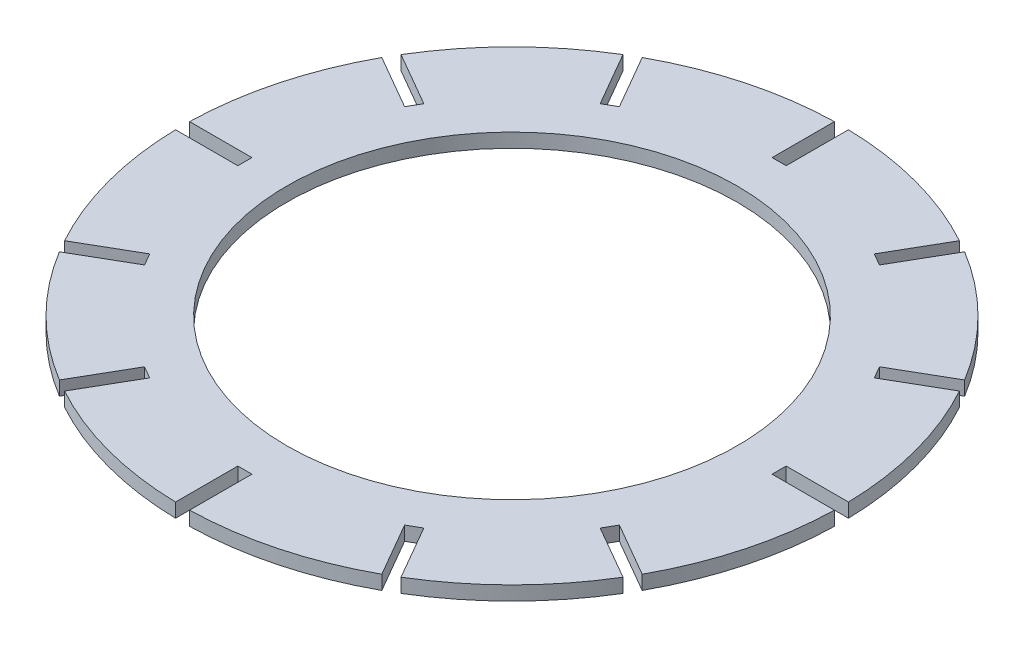
from build123d import *

# Parameters (mm, degrees)
SKETCH1_R           = 70.25
SKETCH1_R_2         = 48
BOSS_EXTRUDE1_DEPTH = 3
SKETCH2_W           = 13.3
SKETCH2_H           = 3
CUT_EXTRUDE1_DEPTH  = 3
CIRPATTERN1_COUNT   = 12


with BuildPart() as part:
    # Sketch1 → Boss-Extrude1 (new body)
    with BuildSketch(Plane(origin=(0, 0, 0), x_dir=(1, 0, 0), z_dir=(0, 1, 0))):
        with Locations(Location((0, 0, 0), (0, 0, 270))):
            Circle(SKETCH1_R)
        with Locations(Location((0, 0, 0), (0, 0, 270))):
            Circle(SKETCH1_R_2, mode=Mode.SUBTRACT)
    extrude(amount=BOSS_EXTRUDE1_DEPTH)

    # Sketch2 → Cut-Extrude1 (cut)
    with BuildSketch(Plane(origin=(0, 3, 0), x_dir=(1, 0, 0), z_dir=(0, 1, 0))):
        with Locations((-63.6, 0)):
            Rectangle(SKETCH2_W, SKETCH2_H)
    cut_extrude1 = extrude(amount=-CUT_EXTRUDE1_DEPTH, mode=Mode.SUBTRACT)

    # CirPattern1: Cut-Extrude1 ×12 about axis
    cirpattern1_axis = Axis((0, 0, 0), (0, 1, 0))
    for i in range(1, CIRPATTERN1_COUNT):
        add(cut_extrude1.rotate(cirpattern1_axis, i * 360 / CIRPATTERN1_COUNT), mode=Mode.SUBTRACT)


solid = part.part
